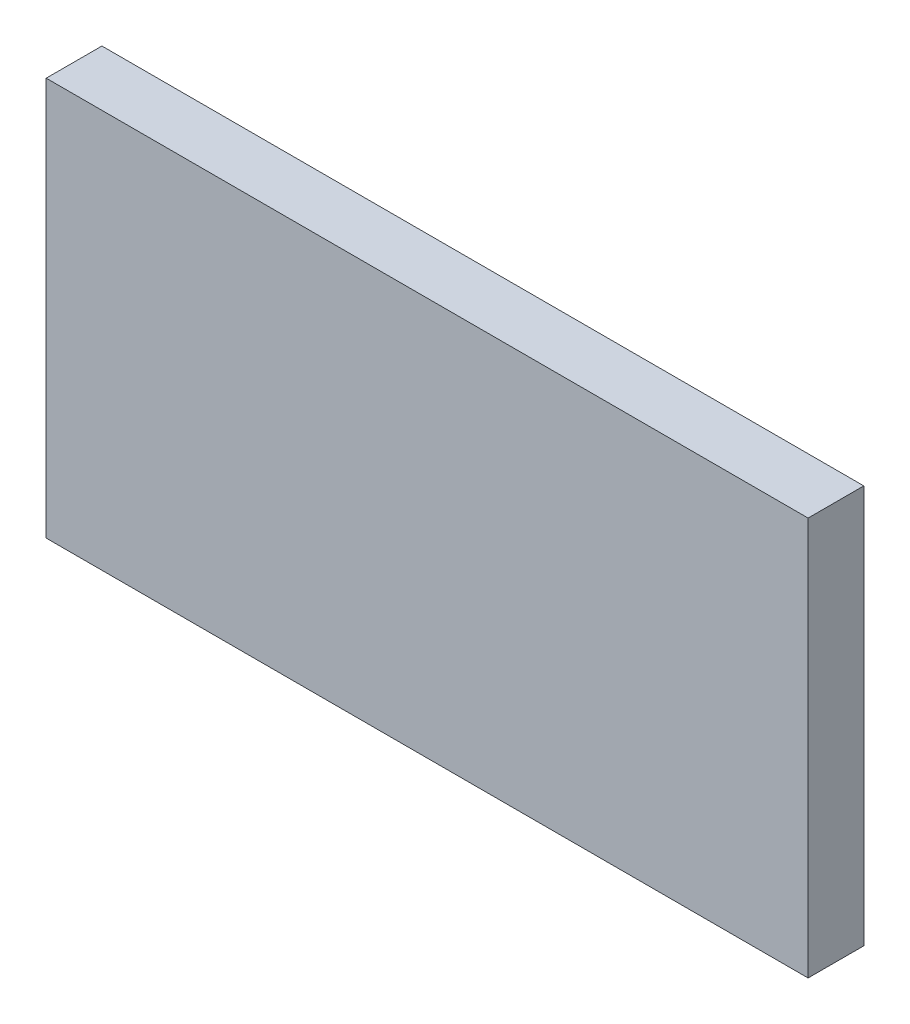
from build123d import *

# Parameters (mm, degrees)
SKETCH1_W           = 136.770554859
SKETCH1_H           = 71.506597146
BOSS_EXTRUDE2_DEPTH = 5


with BuildPart() as part:
    # Sketch1 → Boss-Extrude2 (new, symmetric)
    with BuildSketch(Plane.XY):
        with Locations((1.41878169, 2.837563379)):
            Rectangle(SKETCH1_W, SKETCH1_H)
    extrude(amount=BOSS_EXTRUDE2_DEPTH, both=True)


solid = part.part
